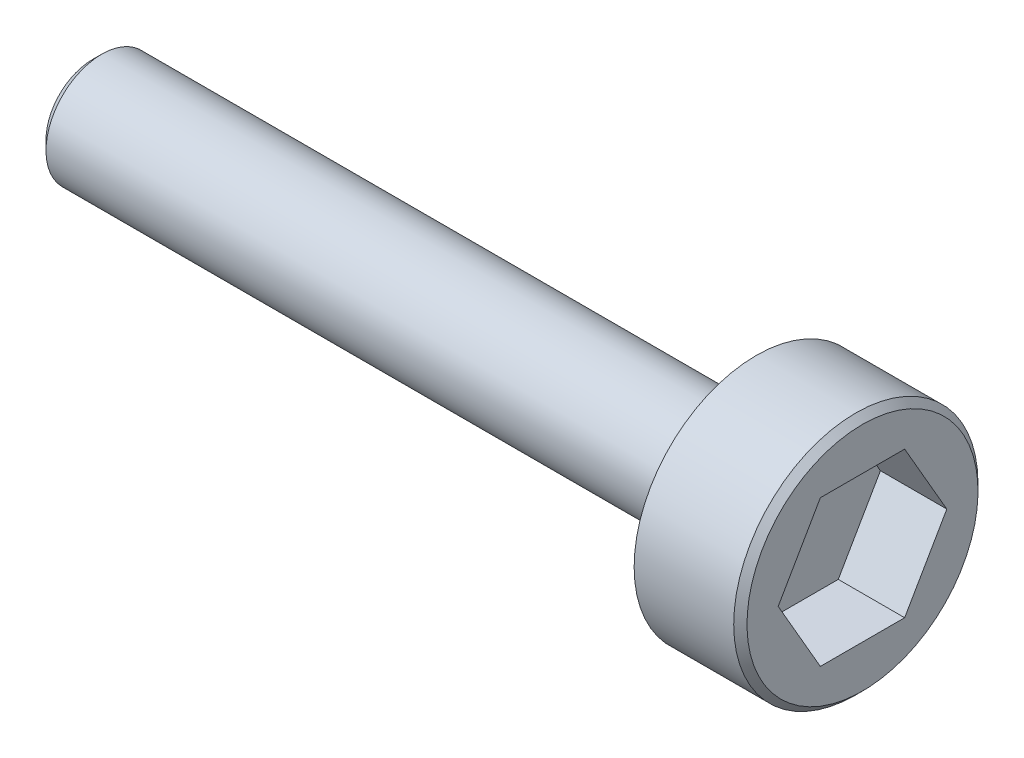
from build123d import *

# Parameters (mm, degrees)
CUT_EXTRUDE1_DEPTH = 2.5


with BuildPart() as part:
    # Sketch1 → Revolve1 (revolve)
    with BuildSketch(Plane.XY):
        Polygon((0, 0), (-25, 0), (-25, 1.75), (-24.65, 2.1), (0, 2.1), (0, 4.6), (3.75, 4.6), (4, 4.35), (4, 0), align=None)
    revolve(axis=Axis((0, 0, 0), (-1, 0, 0)))

    # Sketch2 → Cut-Extrude1 (cut)
    with BuildSketch(Plane(origin=(4, 0, 0), x_dir=(0, 0, -1), z_dir=(1, 0, 0))):
        Polygon((0, 2.75), (-1.58771324, 2.75), (-2.38156986, 1.375), (-3.175426481, 0), (-2.38156986, -1.375), (-1.58771324, -2.75), (0, -2.75), (1.58771324, -2.75), (2.38156986, -1.375), (3.175426481, 0), (2.38156986, 1.375), (1.58771324, 2.75), align=None)
    extrude(amount=-CUT_EXTRUDE1_DEPTH, mode=Mode.SUBTRACT)


solid = part.part
